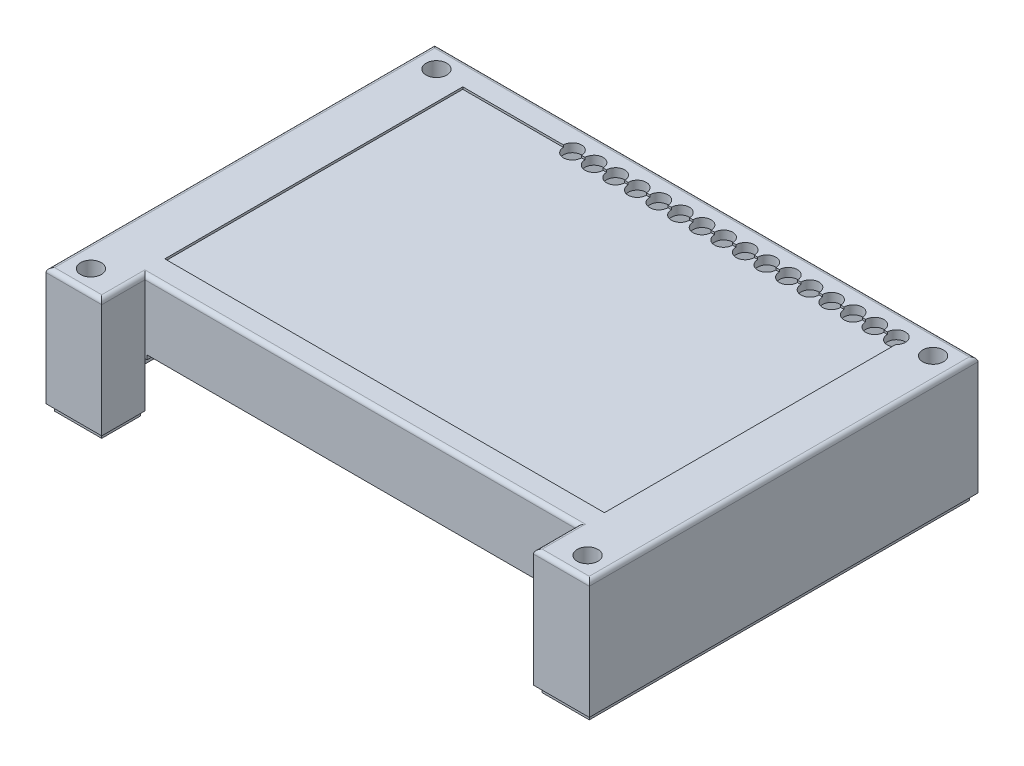
from build123d import *

# Parameters (mm, degrees)
SKETCH_1_W             = 125.8
SKETCH_1_H             = 90
EXTRUDE_1_DEPTH        = 28.8
SKETCH_2_W             = 100
SKETCH_2_H             = 15
CUT_EXTRUDE_1_DEPTH    = 83.527874079
SHELL_1_T              = -2
SKETCH_3_W             = 106
SKETCH_3_H             = 3
CUT_EXTRUDE_2_DEPTH    = 12
EXTRUDE_2_DEPTH        = 26.8
SKETCH_5_R             = 1.75
CUT_EXTRUDE_3_DEPTH    = 83.527874079
SKETCH_6_R             = 2.4
CUT_EXTRUDE_4_DEPTH    = 27
SKETCH_7_W             = 101.8
SKETCH_7_H             = 69
CUT_EXTRUDE_5_DEPTH    = 0.5
FILLET_1_R             = 1
CUT_EXTRUDE_6_DEPTH    = 1.5
SKETCH_9_W             = 99
SKETCH_9_H             = 2
CUT_EXTRUDE_7_DEPTH    = 3
SKETCH_10_W            = 17
SKETCH_10_H            = 15
CUT_EXTRUDE_8_DEPTH    = 3
SKETCH_11_W            = 81
SKETCH_11_H            = 14.5
CUT_EXTRUDE_9_DEPTH    = 3
SKETCH_12_R            = 2.1
CUT_EXTRUDE_10_DEPTH   = 3
PATTERN_LINEAR_1_COUNT = 16
PATTERN_LINEAR_1_PITCH = 5


with BuildPart() as part:
    # Эскиз1 → Бобышка-Вытянуть1 (new body)
    with BuildSketch(Plane(origin=(0, 0, 0), x_dir=(1, 0, 0), z_dir=(0, 1, 0))):
        Rectangle(SKETCH_1_W, SKETCH_1_H)
    extrude(amount=EXTRUDE_1_DEPTH)

    # Эскиз2 → Вырез-Вытянуть1 (cut, through all)
    with BuildSketch(Plane(origin=(0, 28.8, 0), x_dir=(1, 0, 0), z_dir=(0, 1, 0))):
        with Locations((0, -42.5)):
            Rectangle(SKETCH_2_W, SKETCH_2_H)
    extrude(amount=-CUT_EXTRUDE_1_DEPTH, mode=Mode.SUBTRACT)

    # Оболочка1
    shell_1_openings = [part.faces().sort_by_distance(p)[0] for p in [
        (0, 0, -3.875217981),
    ]]
    offset(amount=SHELL_1_T, openings=shell_1_openings, kind=Kind.INTERSECTION)

    # Эскиз3 → Вырез-Вытянуть2 (cut)
    with BuildSketch(Plane.XZ):
        with Locations((0, 33.5)):
            Rectangle(SKETCH_3_W, SKETCH_3_H)
    extrude(amount=-CUT_EXTRUDE_2_DEPTH, mode=Mode.SUBTRACT)

    # Эскиз4 → Бобышка-Вытянуть2 (add)
    with BuildSketch(Plane.XZ.offset(-26.8)):
        with BuildLine():
            Line((-60.9, 43), (-53.9, 43))
            Line((-53.9, 43), (-53.9, 41))
            ThreePointArc((-53.9, 41), (-55.364466094, 37.464466094), (-58.9, 36))
            Line((-58.9, 36), (-60.9, 36))
            Line((-60.9, 36), (-60.9, 43))
        make_face()
        with BuildLine():
            Line((60.9, 43), (53.9, 43))
            Line((53.9, 43), (53.9, 41))
            ThreePointArc((53.9, 41), (55.364466094, 37.464466094), (58.9, 36))
            Line((58.9, 36), (60.9, 36))
            Line((60.9, 36), (60.9, 43))
        make_face()
        with BuildLine():
            Line((-60.9, -43), (-53.9, -43))
            Line((-53.9, -43), (-53.9, -41))
            ThreePointArc((-53.9, -41), (-55.364466094, -37.464466094), (-58.9, -36))
            Line((-58.9, -36), (-60.9, -36))
            Line((-60.9, -36), (-60.9, -43))
        make_face()
        with BuildLine():
            Line((60.9, -43), (53.9, -43))
            Line((53.9, -43), (53.9, -41))
            ThreePointArc((53.9, -41), (55.364466094, -37.464466094), (58.9, -36))
            Line((58.9, -36), (60.9, -36))
            Line((60.9, -36), (60.9, -43))
        make_face()
    extrude(amount=EXTRUDE_2_DEPTH)

    # Эскиз5 → Вырез-Вытянуть3 (cut, through all)
    with BuildSketch(Plane.XZ):
        with Locations(Location((-57.5, 40, 0), (0, 0, 270))):
            Circle(SKETCH_5_R)
        with Locations(Location((57.5, 40, 0), (0, 0, 270))):
            Circle(SKETCH_5_R)
        with Locations(Location((57.5, -40, 0), (0, 0, 270))):
            Circle(SKETCH_5_R)
        with Locations(Location((-57.5, -40, 0), (0, 0, 270))):
            Circle(SKETCH_5_R)
    extrude(amount=-CUT_EXTRUDE_3_DEPTH, mode=Mode.SUBTRACT)

    # Эскиз6 → Вырез-Вытянуть4 (cut)
    with BuildSketch(Plane(origin=(0, 28.8, 0), x_dir=(1, 0, 0), z_dir=(0, 1, 0))):
        with Locations(Location((-57.5, 40, 0), (0, 0, 270))):
            Circle(SKETCH_6_R)
        with Locations(Location((57.5, 40, 0), (0, 0, 270))):
            Circle(SKETCH_6_R)
        with Locations(Location((-57.5, -40, 0), (0, 0, 270))):
            Circle(SKETCH_6_R)
        with Locations(Location((57.5, -40, 0), (0, 0, 270))):
            Circle(SKETCH_6_R)
    extrude(amount=-CUT_EXTRUDE_4_DEPTH, mode=Mode.SUBTRACT)

    # Эскиз7 → Вырез-Вытянуть5 (cut)
    with BuildSketch(Plane(origin=(0, 28.8, 0), x_dir=(1, 0, 0), z_dir=(0, 1, 0))):
        with Locations((0, 5)):
            Rectangle(SKETCH_7_W, SKETCH_7_H)
    extrude(amount=-CUT_EXTRUDE_5_DEPTH, mode=Mode.SUBTRACT)

    # Скругление1
    fillet_1_edges = [part.edges().sort_by_distance(p)[0] for p in [
        (62.9, 28.8, 0),
        (0, 28.8, -45),
        (56.45, 28.8, 45),
        (50, 28.8, 40),
        (0, 28.8, 35),
        (-50, 28.8, 40),
        (-62.9, 28.8, 0),
        (-56.45, 28.8, 45),
    ]]
    fillet(fillet_1_edges, radius=FILLET_1_R)

    # Эскиз8 → Вырез-Вытянуть6 (cut)
    with BuildSketch(Plane.XZ):
        Polygon((-51, 32), (-51, 44), (-61.9, 44), (-61.9, -44), (61.9, -44), (61.9, 44), (51, 44), (51, 32), (49, 32), (49, 46), (63.9, 46), (63.9, -46), (-63.9, -46), (-63.9, 46), (-49, 46), (-49, 32), align=None)
    extrude(amount=-CUT_EXTRUDE_6_DEPTH, mode=Mode.SUBTRACT)

    # Эскиз9 → Вырез-Вытянуть7 (cut)
    with BuildSketch(Plane.XY.offset(35)):
        with Locations((0, 12)):
            Rectangle(SKETCH_9_W, SKETCH_9_H)
    extrude(amount=-CUT_EXTRUDE_7_DEPTH, mode=Mode.SUBTRACT)

    # Эскиз10 → Вырез-Вытянуть8 (cut)
    with BuildSketch(Plane(origin=(0, 0, -45), x_dir=(-1, 0, 0), z_dir=(0, 0, -1))):
        with Locations((43.4, 6.5)):
            Rectangle(SKETCH_10_W, SKETCH_10_H)
    extrude(amount=-CUT_EXTRUDE_8_DEPTH, mode=Mode.SUBTRACT)

    # Эскиз11 → Вырез-Вытянуть9 (cut)
    with BuildSketch(Plane(origin=(0, 0, -45), x_dir=(-1, 0, 0), z_dir=(0, 0, -1))):
        with Locations((-12, 6.25)):
            Rectangle(SKETCH_11_W, SKETCH_11_H)
    extrude(amount=-CUT_EXTRUDE_9_DEPTH, mode=Mode.SUBTRACT)

    # Эскиз12 → Вырез-Вытянуть10 (cut)
    with BuildSketch(Plane(origin=(0, 28.8, 0), x_dir=(1, 0, 0), z_dir=(0, 1, 0))):
        with Locations(Location((49.5, 39.5, 0), (0, 0, 270))):
            Circle(SKETCH_12_R)
    cut_extrude_10 = extrude(amount=-CUT_EXTRUDE_10_DEPTH, mode=Mode.SUBTRACT)

    # Линейный массив1: Вырез-Вытянуть10 ×16
    with Locations(*[(-i * PATTERN_LINEAR_1_PITCH, 0, 0) for i in range(1, PATTERN_LINEAR_1_COUNT)]):
        add(cut_extrude_10, mode=Mode.SUBTRACT)


solid = part.part
